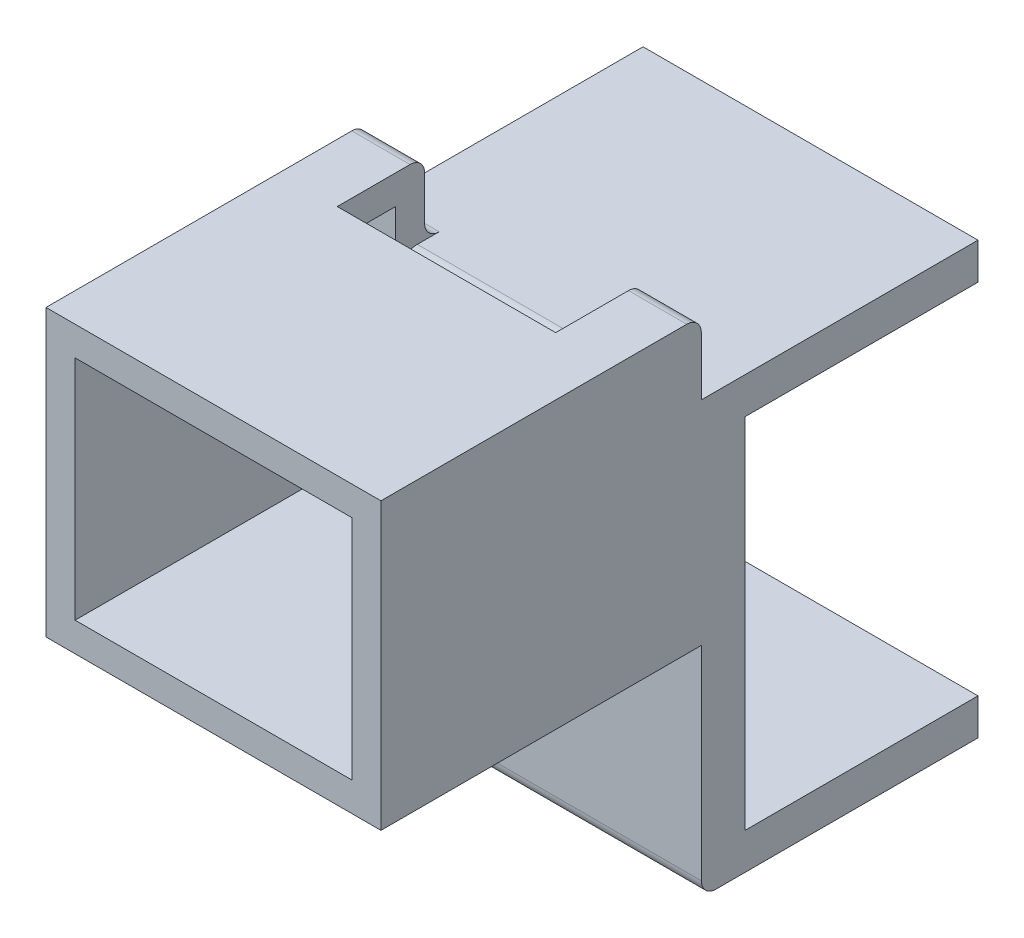
from build123d import *

# Parameters (mm, degrees)
ESQUISSE1_W             = 11.5
ESQUISSE1_H             = 9.8
BOSS_EXTRU_1_DEPTH      = 11
ESQUISSE2_W             = 9.5
ESQUISSE2_H             = 7.8
ENL_V_MAT_EXTRU_1_DEPTH = 10
ESQUISSE3_W             = 7.5
ESQUISSE3_H             = 3
ENL_V_MAT_EXTRU_2_DEPTH = 2.5
CONG_1_R                = 0.75
ESQUISSE4_W             = 11.5
ESQUISSE4_H             = 14.8
BOSS_EXTRU_2_DEPTH      = 1.5
ESQUISSE5_W             = 11.5
ESQUISSE5_H             = 1.25
BOSS_EXTRU_3_DEPTH      = 8
CONG_2_R                = 0.5
CONG_3_R                = 0.5


with BuildPart() as part:
    # Esquisse1 → Boss.-Extru.1 (new body)
    with BuildSketch(Plane.XY):
        with Locations((5.75, 4.9)):
            Rectangle(ESQUISSE1_W, ESQUISSE1_H)
    extrude(amount=BOSS_EXTRU_1_DEPTH)

    # Esquisse2 → Enlèv. mat.-Extru.1 (cut)
    with BuildSketch(Plane.XY.offset(11)):
        with Locations((5.75, 4.9)):
            Rectangle(ESQUISSE2_W, ESQUISSE2_H)
    extrude(amount=-ENL_V_MAT_EXTRU_1_DEPTH, mode=Mode.SUBTRACT)

    # Esquisse3 → Enlèv. mat.-Extru.2 (cut)
    with BuildSketch(Plane(origin=(0, 9.8, 0), x_dir=(1, 0, 0), z_dir=(0, 1, 0))):
        with Locations((5.75, -1.5)):
            Rectangle(ESQUISSE3_W, ESQUISSE3_H)
    extrude(amount=-ENL_V_MAT_EXTRU_2_DEPTH, mode=Mode.SUBTRACT)

    # Congé1
    cong_1_edges = [part.edges().sort_by_distance(p)[0] for p in [
        (5.75, 7.3, 1),
        (5.75, 8.8, 3),
    ]]
    fillet(cong_1_edges, radius=CONG_1_R)

    # Esquisse4 → Boss.-Extru.2 (add)
    with BuildSketch(Plane(origin=(0, 0, 0), x_dir=(-1, 0, 0), z_dir=(0, 0, -1))):
        with Locations((-5.75, -0.1)):
            Rectangle(ESQUISSE4_W, ESQUISSE4_H)
    extrude(amount=BOSS_EXTRU_2_DEPTH)

    # Esquisse5 → Boss.-Extru.3 (add)
    with BuildSketch(Plane(origin=(0, 0, -1.5), x_dir=(-1, 0, 0), z_dir=(0, 0, -1))):
        with Locations((-5.75, 6.675)):
            Rectangle(ESQUISSE5_W, ESQUISSE5_H)
        with Locations((-5.75, -6.875)):
            Rectangle(ESQUISSE5_W, ESQUISSE5_H)
    extrude(amount=BOSS_EXTRU_3_DEPTH)

    # Congé2
    cong_2_edges = [part.edges().sort_by_distance(p)[0] for p in [
        (5.75, -7.5, 0),
    ]]
    fillet(cong_2_edges, radius=CONG_2_R)

    # Congé3
    cong_3_edges = [part.edges().sort_by_distance(p)[0] for p in [
        (1, 9.8, 0),
        (10.5, 9.8, 0),
        (1, 7.3, 0),
    ]]
    fillet(cong_3_edges, radius=CONG_3_R)


solid = part.part
